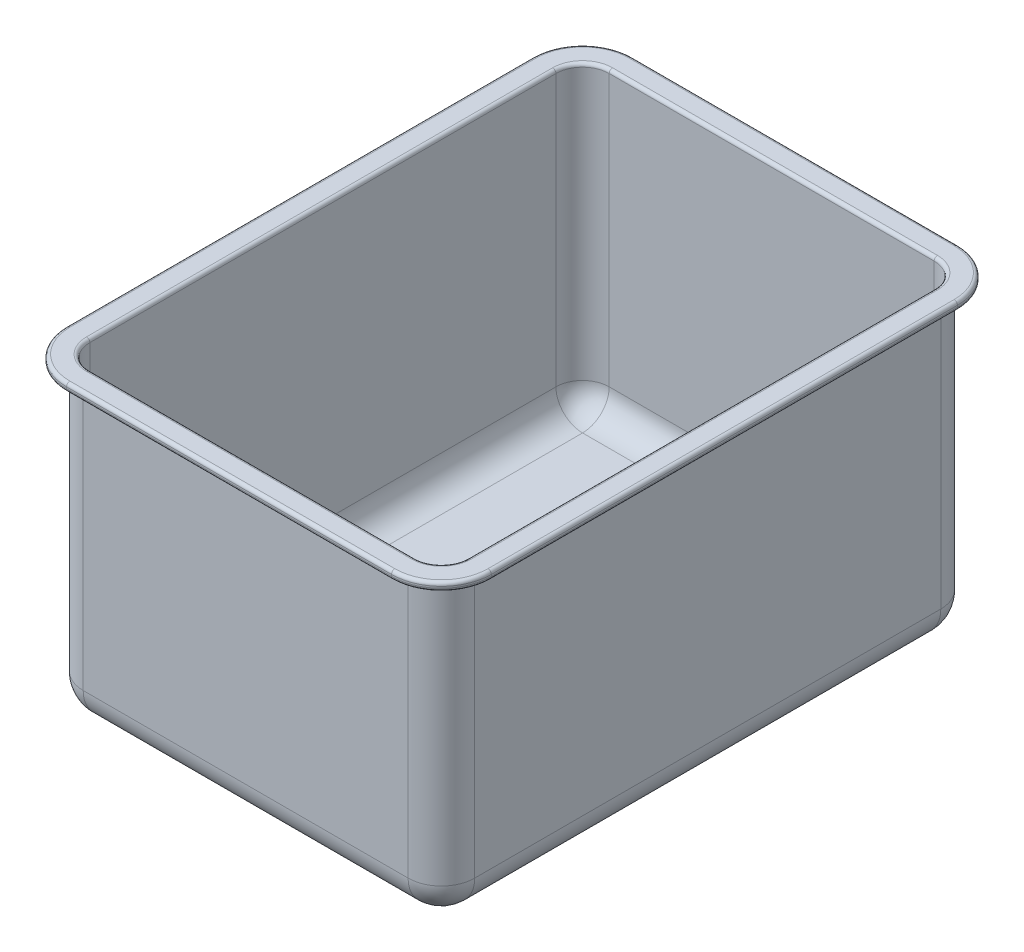
from build123d import *

# Parameters (mm, degrees)
SKETCH1_W           = 149.352
SKETCH1_H           = 203.2
BOSS_EXTRUDE1_DEPTH = 114.3
FILLET1_R           = 12.7
SHELL1_T            = -2.54
BOSS_EXTRUDE2_START = 3.175
BOSS_EXTRUDE2_DEPTH = 3.175
FILLET2_R           = 1.27


with BuildPart() as part:
    # Sketch1 → Boss-Extrude1 (new body)
    with BuildSketch(Plane(origin=(0, 0, 0), x_dir=(1, 0, 0), z_dir=(0, 1, 0))):
        Rectangle(SKETCH1_W, SKETCH1_H)
    extrude(amount=BOSS_EXTRUDE1_DEPTH)

    # Fillet1
    fillet1_edges = [part.edges().sort_by_distance(p)[0] for p in [
        (0, 0, 101.6),
        (-74.676, 0, 0),
        (0, 0, -101.6),
        (74.676, 0, 0),
        (74.676, 57.15, 101.6),
        (-74.676, 57.15, 101.6),
        (-74.676, 57.15, -101.6),
        (74.676, 57.15, -101.6),
    ]]
    fillet(fillet1_edges, radius=FILLET1_R)

    # Shell1
    shell1_openings = [part.faces().sort_by_distance(p)[0] for p in [
        (0, 114.3, 0),
    ]]
    offset(amount=SHELL1_T, openings=shell1_openings, kind=Kind.INTERSECTION)

    # Sketch2 → Boss-Extrude2 (add)
    with BuildSketch(Plane(origin=(0, 114.3, 0), x_dir=(1, 0, 0), z_dir=(0, 1, 0)).offset(BOSS_EXTRUDE2_START)):
        with BuildLine():
            Line((61.976, 107.95), (-61.976, 107.95))
            ThreePointArc((-61.976, 107.95), (-75.446384182, 102.370384182), (-81.026, 88.9))
            Line((-81.026, 88.9), (-81.026, -88.9))
            ThreePointArc((-81.026, -88.9), (-75.446384182, -102.370384182), (-61.976, -107.95))
            Line((-61.976, -107.95), (61.976, -107.95))
            ThreePointArc((61.976, -107.95), (75.446384182, -102.370384182), (81.026, -88.9))
            Line((81.026, -88.9), (81.026, 88.9))
            ThreePointArc((81.026, 88.9), (75.446384182, 102.370384182), (61.976, 107.95))
        make_face()
        with BuildLine():
            Line((-72.136, 88.9), (-72.136, -88.9))
            ThreePointArc((-72.136, -88.9), (-69.160204897, -96.084204897), (-61.976, -99.06))
            Line((-61.976, -99.06), (61.976, -99.06))
            ThreePointArc((61.976, -99.06), (69.160204897, -96.084204897), (72.136, -88.9))
            Line((72.136, -88.9), (72.136, 88.9))
            ThreePointArc((72.136, 88.9), (69.160204897, 96.084204897), (61.976, 99.06))
            Line((61.976, 99.06), (-61.976, 99.06))
            ThreePointArc((-61.976, 99.06), (-69.160204897, 96.084204897), (-72.136, 88.9))
        make_face(mode=Mode.SUBTRACT)
    extrude(amount=-BOSS_EXTRUDE2_DEPTH)

    # Fillet2
    fillet2_edges = [part.edges().sort_by_distance(p)[0] for p in [
        (75.446384182, 117.475, -102.370384182),
        (0, 117.475, -107.95),
        (-75.446384182, 117.475, -102.370384182),
        (-81.026, 117.475, 0),
        (-75.446384182, 117.475, 102.370384182),
        (0, 117.475, 107.95),
        (75.446384182, 117.475, 102.370384182),
        (81.026, 117.475, 0),
        (75.446384182, 114.3, -102.370384182),
        (0, 114.3, -107.95),
        (-75.446384182, 114.3, -102.370384182),
        (-81.026, 114.3, 0),
        (-75.446384182, 114.3, 102.370384182),
        (0, 114.3, 107.95),
        (75.446384182, 114.3, 102.370384182),
        (81.026, 114.3, 0),
        (-69.160204897, 117.475, -96.084204897),
        (-72.136, 117.475, 0),
        (-69.160204897, 117.475, 96.084204897),
        (0, 117.475, 99.06),
        (69.160204897, 117.475, 96.084204897),
        (72.136, 117.475, 0),
        (69.160204897, 117.475, -96.084204897),
        (0, 117.475, -99.06),
    ]]
    fillet(fillet2_edges, radius=FILLET2_R)


solid = part.part
